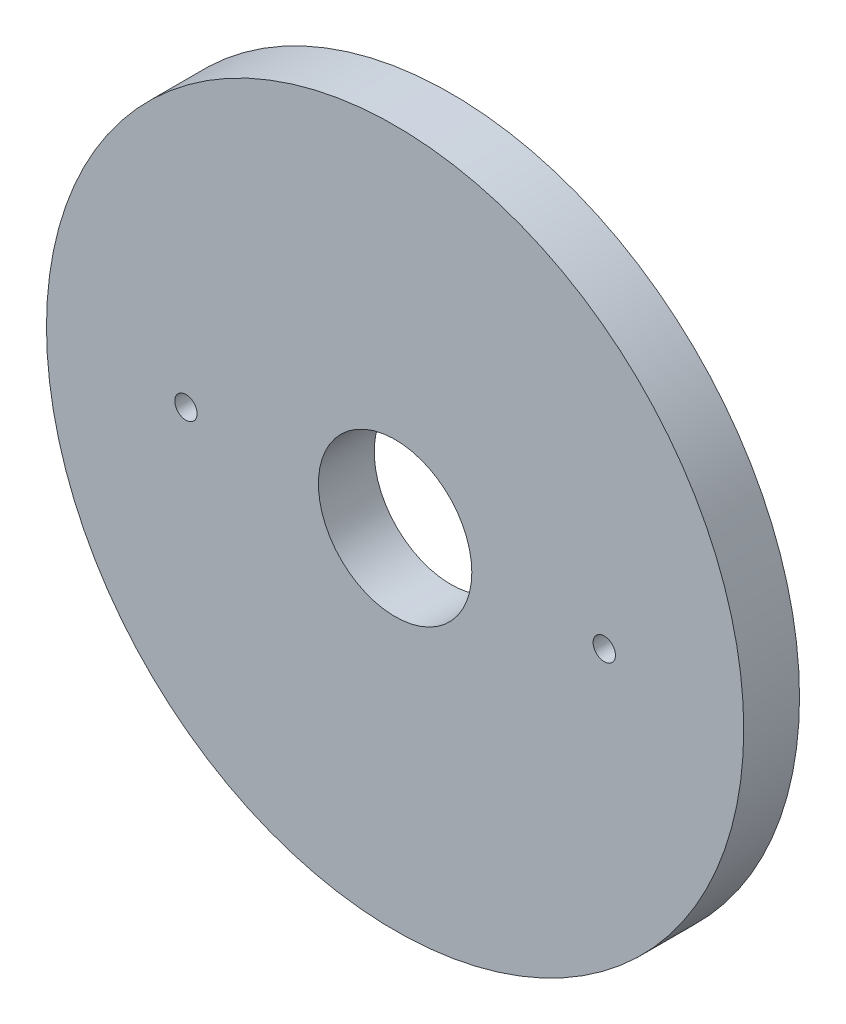
from build123d import *

# Parameters (mm, degrees)
ESQUISSE1_R             = 50
ESQUISSE1_R_2           = 11
BOSS_EXTRU_1_DEPTH      = 8
ESQUISSE2_R             = 1.6
ENL_V_MAT_EXTRU_1_DEPTH = 72.161787499
ESQUISSE3_R             = 2.85
ENL_V_MAT_EXTRU_2_DEPTH = 3


with BuildPart() as part:
    # Esquisse1 → Boss.-Extru.1 (new body)
    with BuildSketch(Plane.XY):
        Circle(ESQUISSE1_R)
        Circle(ESQUISSE1_R_2, mode=Mode.SUBTRACT)
    extrude(amount=BOSS_EXTRU_1_DEPTH)

    # Esquisse2 → Enlèv. mat.-Extru.1 (cut, through all)
    with BuildSketch(Plane(origin=(0, 0, 0), x_dir=(-1, 0, 0), z_dir=(0, 0, -1))):
        with Locations((30, 0)):
            Circle(ESQUISSE2_R)
        with Locations((-30, 0)):
            Circle(ESQUISSE2_R)
    extrude(amount=-ENL_V_MAT_EXTRU_1_DEPTH, mode=Mode.SUBTRACT)

    # Esquisse3 → Enlèv. mat.-Extru.2 (cut)
    with BuildSketch(Plane(origin=(0, 0, 0), x_dir=(-1, 0, 0), z_dir=(0, 0, -1))):
        with Locations((30, 0)):
            Circle(ESQUISSE3_R)
        with Locations((-30, 0)):
            Circle(ESQUISSE3_R)
    extrude(amount=-ENL_V_MAT_EXTRU_2_DEPTH, mode=Mode.SUBTRACT)


solid = part.part
